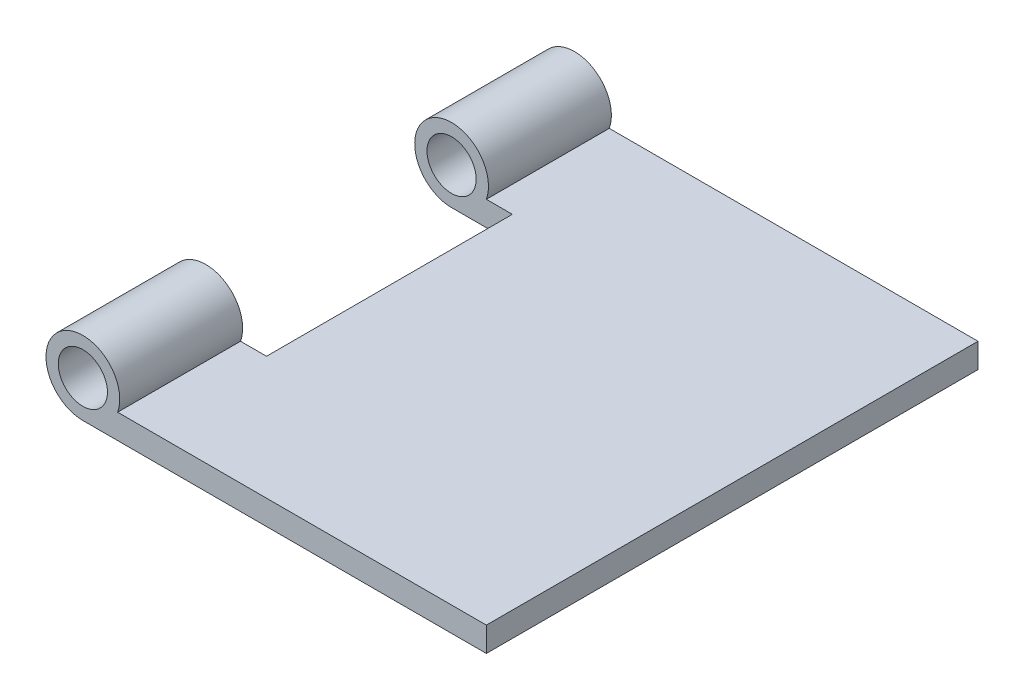
from build123d import *

# Parameters (mm, degrees)
SKETCH_1_R          = 2
EXTRUDE_1_DEPTH     = 40
SKETCH_2_W          = 10.776638496
SKETCH_2_H          = 20
CUT_EXTRUDE_2_DEPTH = 20


with BuildPart() as part:
    # Эскиз1 → Вытянуть1 (new body)
    with BuildSketch(Plane.XY):
        with BuildLine():
            Line((2.828427125, -1), (32.828427125, -1))
            Line((32.828427125, -1), (32.828427125, -3))
            Line((32.828427125, -3), (0, -3))
            ThreePointArc((0, -3), (-1.732050808, 2.449489743), (2.828427125, -1))
        make_face()
        Circle(SKETCH_1_R, mode=Mode.SUBTRACT)
    extrude(amount=EXTRUDE_1_DEPTH)

    # Эскиз2 → Вытянуть2 (cut, symmetric)
    with BuildSketch(Plane(origin=(0, 0, 0), x_dir=(1, 0, 0), z_dir=(0, 1, 0))):
        with Locations((-0.445273779, -20)):
            Rectangle(SKETCH_2_W, SKETCH_2_H)
    extrude(amount=CUT_EXTRUDE_2_DEPTH, both=True, mode=Mode.SUBTRACT)


solid = part.part
